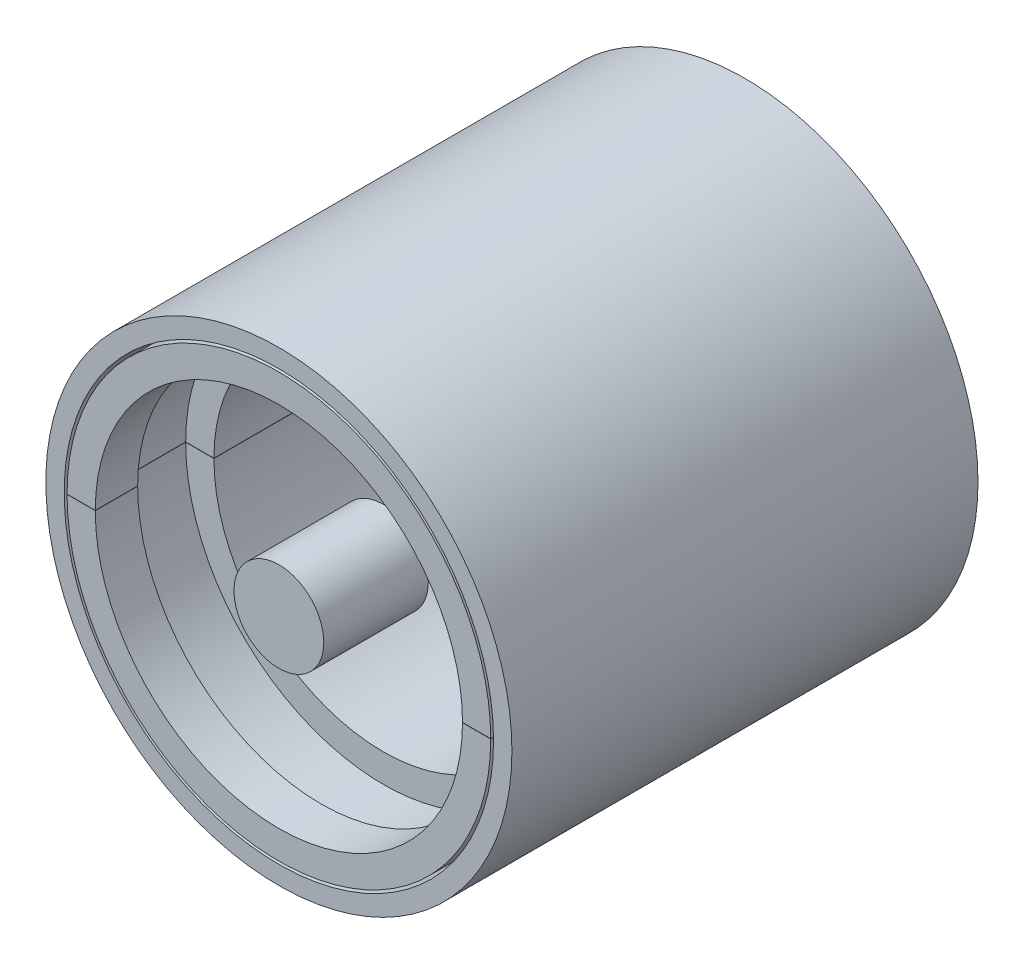
from build123d import *

# Parameters (mm, degrees)
SKETCH1_R            = 7.5
SKETCH1_R_2          = 6.5
BOSS_EXTRUDE1_DEPTH  = 1.5
BOSS_EXTRUDE2_START  = 8
SKETCH2_R            = 7.5
SKETCH2_R_2          = 7
BOSS_EXTRUDE2_DEPTH  = 8
BOSS_EXTRUDE3_START  = 4.75
SKETCH3_R            = 7.5
BOSS_EXTRUDE3_DEPTH  = 4.75
BOSS_EXTRUDE4_START  = 1.25
SKETCH4_R            = 7.5
SKETCH4_R_2          = 5
BOSS_EXTRUDE4_DEPTH  = 1.25
CUT_EXTRUDE1_REACH   = 20.782
SKETCH5_W            = 16.797198
SKETCH5_H            = 0.01
SKETCH6_R            = 8.25
BOSS_EXTRUDE5_DEPTH  = 1
SKETCH7_R            = 8.25
SKETCH7_R_2          = 7.6
BOSS_EXTRUDE6_DEPTH  = 15.5
SKETCH8_R            = 7.25
CUT_EXTRUDE2_DEPTH   = 16.5
SKETCH11_R           = 1.58979
BOSS_EXTRUDE8_DEPTH  = 3.7
BOSS_EXTRUDE10_DEPTH = 5.8


with BuildPart() as part:
    # Sketch1 → Boss-Extrude1 (new body)
    with BuildSketch(Plane.XY):
        Circle(SKETCH1_R)
        Circle(SKETCH1_R_2, mode=Mode.SUBTRACT)
    extrude(amount=BOSS_EXTRUDE1_DEPTH)

    # Sketch2 → Boss-Extrude2 (add)
    with BuildSketch(Plane(origin=(0, 0, 0), x_dir=(-1, 0, 0), z_dir=(0, 0, -1)).offset(BOSS_EXTRUDE2_START)):
        Circle(SKETCH2_R)
        Circle(SKETCH2_R_2, mode=Mode.SUBTRACT)
    extrude(amount=-BOSS_EXTRUDE2_DEPTH)

    # Sketch3 → Boss-Extrude3 (add)
    with BuildSketch(Plane(origin=(0, 0, -8), x_dir=(-1, 0, 0), z_dir=(0, 0, -1)).offset(BOSS_EXTRUDE3_START)):
        Circle(SKETCH3_R)
        Polygon((-7.072541, 0), (-3.53627, -6.125), (3.53627, -6.125), (7.072541, 0), (3.53627, 6.125), (-3.53627, 6.125), align=None, mode=Mode.SUBTRACT)
    extrude(amount=-BOSS_EXTRUDE3_DEPTH)

    # Sketch4 → Boss-Extrude4 (add)
    with BuildSketch(Plane(origin=(0, 0, -12.75), x_dir=(-1, 0, 0), z_dir=(0, 0, -1)).offset(BOSS_EXTRUDE4_START)):
        Circle(SKETCH4_R)
        Circle(SKETCH4_R_2, mode=Mode.SUBTRACT)
    extrude(amount=-BOSS_EXTRUDE4_DEPTH)

    # Cut-Extrude1: up to this face of the body (flat: up to its plane)
    cut_extrude1_end = Plane(part.part.faces().sort_by_distance((7.287868, 0, -14))[0])
    # Sketch5 → Cut-Extrude1 (cut, up to the picked face)
    with BuildSketch(Plane.XY.offset(1.5), mode=Mode.PRIVATE) as cut_extrude1_sk1:
        with Locations((-0.172406, 0)):
            Rectangle(SKETCH5_W, SKETCH5_H)
    cut_extrude1_tool1 = split(extrude(cut_extrude1_sk1.sketch, amount=-CUT_EXTRUDE1_REACH, mode=Mode.PRIVATE), bisect_by=cut_extrude1_end, keep=Keep.BOTH, mode=Mode.PRIVATE)
    add(cut_extrude1_tool1.solids().sort_by(Axis((-0.172406, 0, 1.5), (0, 0, -1)))[0], mode=Mode.SUBTRACT)


with BuildPart() as cut_extrude1_piece_1:
    # of the separate pieces the step leaves, piece 1, a body of its own (cut_extrude1_pieces)
    add(part.part.solids().sort_by_distance((7.499998, -0.005, -14))[0])



with BuildPart() as cut_extrude1_piece_2:
    # of the separate pieces the step leaves, piece 2, a body of its own (cut_extrude1_pieces)
    add(part.part.solids().sort_by_distance((-7.499998, 0.005, -14))[0])


with BuildPart() as body_3:
    # Sketch6 → Boss-Extrude5 (new body)
    with BuildSketch(Plane(origin=(0, 0, -14), x_dir=(-1, 0, 0), z_dir=(0, 0, -1))):
        Circle(SKETCH6_R)
    extrude(amount=BOSS_EXTRUDE5_DEPTH)

    # Sketch7 → Boss-Extrude6 (add)
    with BuildSketch(Plane.XY.offset(-14)):
        Circle(SKETCH7_R)
        Circle(SKETCH7_R_2, mode=Mode.SUBTRACT)
    extrude(amount=BOSS_EXTRUDE6_DEPTH)

    # Sketch8 → Cut-Extrude2 (cut)
    with BuildSketch(Plane(origin=(0, 0, -15), x_dir=(-1, 0, 0), z_dir=(0, 0, -1))):
        Circle(SKETCH8_R)
    extrude(amount=-CUT_EXTRUDE2_DEPTH, mode=Mode.SUBTRACT)


with BuildPart() as body_4:
    # Sketch11 → Boss-Extrude8 (new body)
    with BuildSketch(Plane.XY.offset(1.5)):
        Circle(SKETCH11_R)
    extrude(amount=-BOSS_EXTRUDE8_DEPTH)


with BuildPart() as cut_extrude1_piece_1_1:
    add(cut_extrude1_piece_1.part)

    add(cut_extrude1_piece_2.part)  # Boss-Extrude10 merges Cut-Extrude1 piece 2
    # Sketch12 → Boss-Extrude10 (add)
    with BuildSketch(Plane(origin=(0, 0, -2.2), x_dir=(-1, 0, 0), z_dir=(0, 0, -1))):
        with BuildLine():
            ThreePointArc((7.499998, 0.005), (0, 7.5), (-7.499998, 0.005))
            Line((-7.499998, 0.005), (-5.999998, 0.005))
            ThreePointArc((-5.999998, 0.005), (0, 6), (5.999998, 0.005))
            Line((5.999998, 0.005), (7.499998, 0.005))
        make_face()
        with BuildLine():
            Line((-5.999998, -0.005), (-7.499998, -0.005))
            ThreePointArc((-7.499998, -0.005), (0, -7.5), (7.499998, -0.005))
            Line((7.499998, -0.005), (5.999998, -0.005))
            ThreePointArc((5.999998, -0.005), (0, -6), (-5.999998, -0.005))
        make_face()
    extrude(amount=BOSS_EXTRUDE10_DEPTH)


solid = Compound([body_3.part, body_4.part, cut_extrude1_piece_1_1.part])
